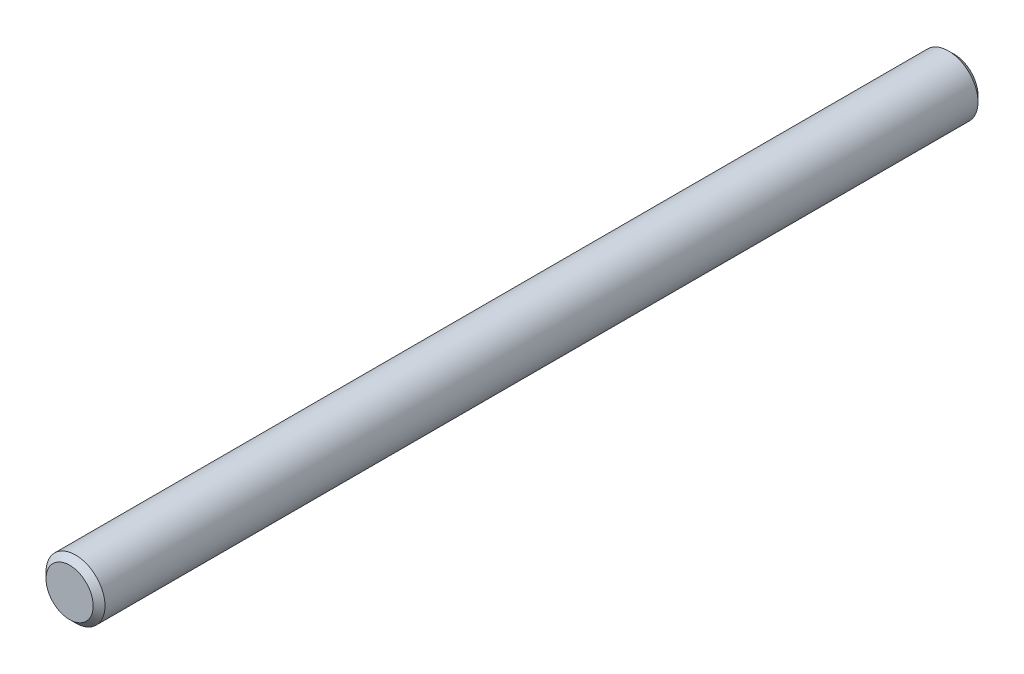
from build123d import *

# Parameters (mm, degrees)
ESBO_O1_R                = 2.5
RESSALTO_EXTRUS_O1_DEPTH = 75
CHANFRO1_SIZE            = 0.5


with BuildPart() as part:
    # Esboço1 → Ressalto-extrusão1 (new body)
    with BuildSketch(Plane.XY):
        Circle(ESBO_O1_R)
    extrude(amount=RESSALTO_EXTRUS_O1_DEPTH)

    # Chanfro1
    chanfro1_edges = [part.edges().sort_by_distance(p)[0] for p in [
        (-2.5, 0, 0),
        (-2.5, 0, 75),
    ]]
    chamfer(chanfro1_edges, length=CHANFRO1_SIZE)


solid = part.part
